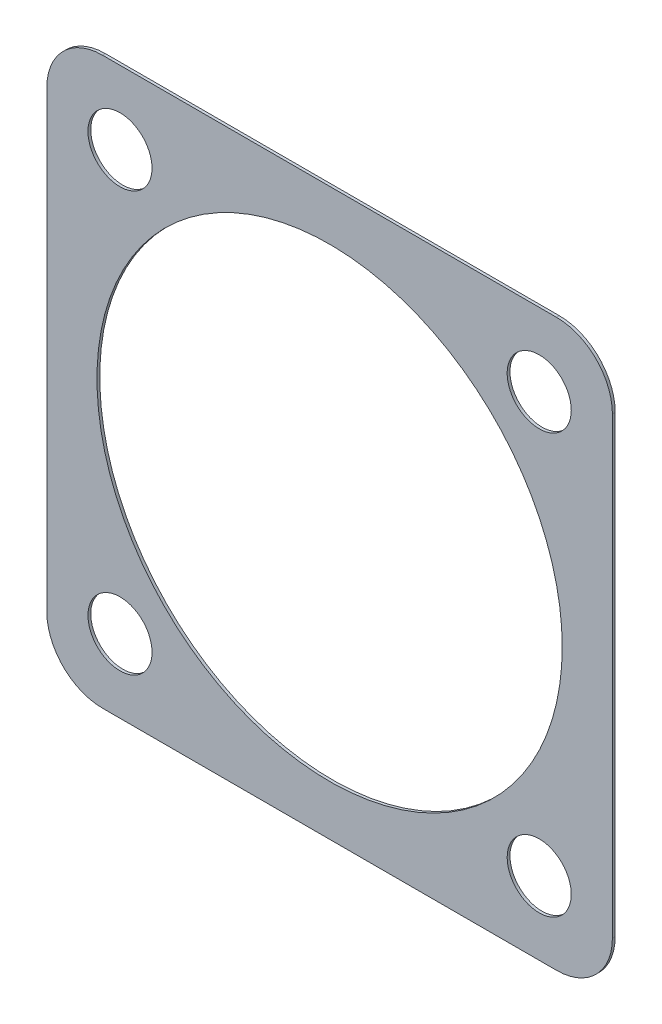
from build123d import *

# Parameters (mm, degrees)
SKETCH1_R      = 5.75
SKETCH1_R_2    = 41.75
EXTRUDE1_DEPTH = 0.5


with BuildPart() as part:
    # Sketch1 → Extrude1 (new body)
    with BuildSketch(Plane.XY):
        with BuildLine():
            Line((-40.75, 50.75), (40.75, 50.75))
            ThreePointArc((40.75, 50.75), (47.821067812, 47.821067812), (50.75, 40.75))
            Line((50.75, 40.75), (50.75, -40.75))
            ThreePointArc((50.75, -40.75), (47.821067812, -47.821067812), (40.75, -50.75))
            Line((40.75, -50.75), (-40.75, -50.75))
            ThreePointArc((-40.75, -50.75), (-47.821067812, -47.821067812), (-50.75, -40.75))
            Line((-50.75, -40.75), (-50.75, 40.75))
            ThreePointArc((-50.75, 40.75), (-47.821067812, 47.821067812), (-40.75, 50.75))
        make_face()
        with Locations((37.618080759, 37.618080759)):
            Circle(SKETCH1_R, mode=Mode.SUBTRACT)
        with Locations(Location((-37.618080759, 37.618080759, 0), (0, 0, 180))):
            Circle(SKETCH1_R, mode=Mode.SUBTRACT)
        with Locations((-37.618080759, -37.618080759)):
            Circle(SKETCH1_R, mode=Mode.SUBTRACT)
        with Locations(Location((37.618080759, -37.618080759, 0), (0, 0, 180))):
            Circle(SKETCH1_R, mode=Mode.SUBTRACT)
        Circle(SKETCH1_R_2, mode=Mode.SUBTRACT)
    extrude(amount=EXTRUDE1_DEPTH)


solid = part.part
